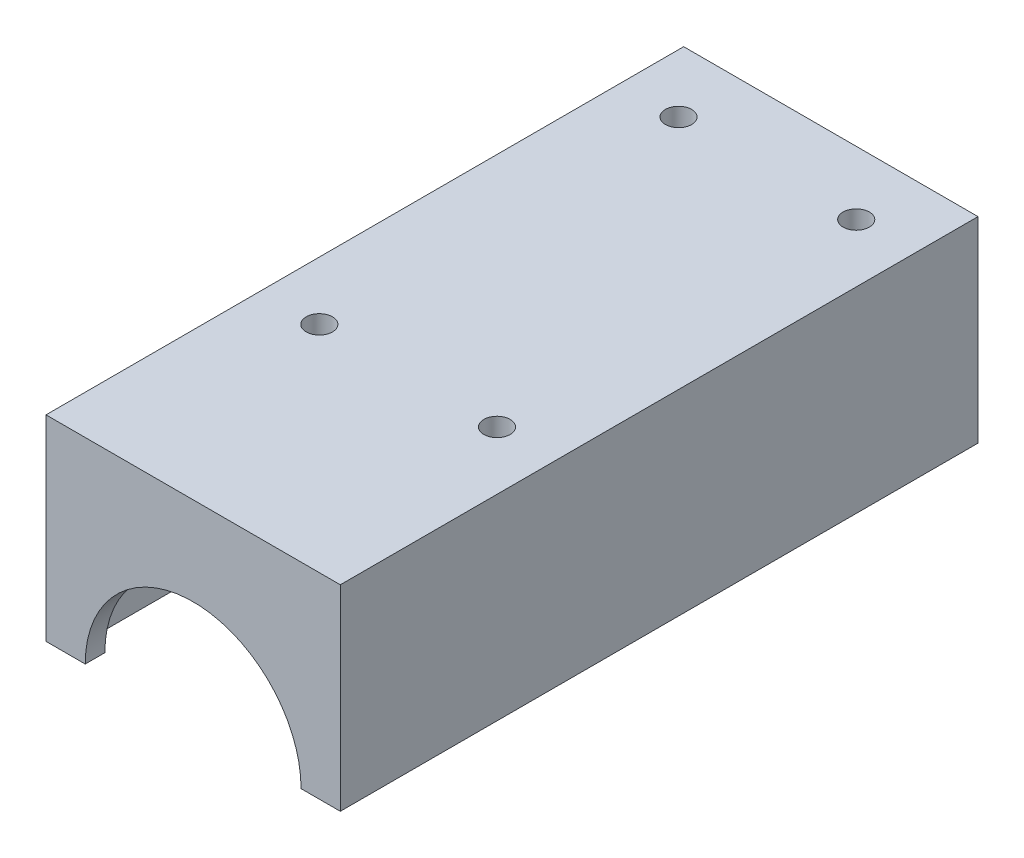
from build123d import *

# Parameters (mm, degrees)
SKETCH1_W           = 38.1
SKETCH1_H           = 82.55
BOSS_EXTRUDE1_DEPTH = 12.7
SHELL1_T            = -2.54
SKETCH2_R           = 13.97
CUT_EXTRUDE1_DEPTH  = 86.666183527
SKETCH3_R           = 1.7
CUT_EXTRUDE2_DEPTH  = 51.883275494
EXTRUDE_THIN1_START = 11.43
SKETCH4_R           = 2.97
SKETCH4_R_2         = 1.7
EXTRUDE_THIN1_DEPTH = 11.43
CUT_EXTRUDE3_DEPTH  = 2.54


with BuildPart() as part:
    # Sketch1 → Boss-Extrude1 (new, symmetric)
    with BuildSketch(Plane(origin=(0, 0, 0), x_dir=(1, 0, 0), z_dir=(0, 1, 0))):
        Rectangle(SKETCH1_W, SKETCH1_H)
    extrude(amount=BOSS_EXTRUDE1_DEPTH, both=True)

    # Shell1
    shell1_openings = [part.faces().sort_by_distance(p)[0] for p in [
        (0, -12.7, 0),
    ]]
    offset(amount=SHELL1_T, openings=shell1_openings, kind=Kind.INTERSECTION)

    # Sketch2 → Cut-Extrude1 (cut, through all)
    with BuildSketch(Plane(origin=(0, 0, -41.275), x_dir=(-1, 0, 0), z_dir=(0, 0, -1))):
        with Locations((0, -12.7)):
            Circle(SKETCH2_R)
    extrude(amount=-CUT_EXTRUDE1_DEPTH, mode=Mode.SUBTRACT)

    # Sketch3 → Cut-Extrude2 (cut, through all)
    with BuildSketch(Plane.XZ.offset(-10.16)):
        with Locations(Location((11.5, 13.44, 0), (0, 0, 270))):
            Circle(SKETCH3_R)
        with Locations(Location((11.5, -33.06, 0), (0, 0, 270))):
            Circle(SKETCH3_R)
        with Locations(Location((-11.5, -33.06, 0), (0, 0, 270))):
            Circle(SKETCH3_R)
        with Locations(Location((-11.5, 13.44, 0), (0, 0, 270))):
            Circle(SKETCH3_R)
    extrude(amount=-CUT_EXTRUDE2_DEPTH, mode=Mode.SUBTRACT)

    # Sketch4 → Extrude-Thin1 (add)
    # profile 1 of 4: a face of its own
    with BuildSketch(Plane.XZ.offset(-10.16).offset(EXTRUDE_THIN1_START)):
        with Locations((11.5, 13.44)):
            Circle(SKETCH4_R)
        with Locations((11.5, 13.44)):
            Circle(SKETCH4_R_2, mode=Mode.SUBTRACT)
    # profile 2 of 4: a face of its own
    with BuildSketch(Plane.XZ.offset(-10.16).offset(EXTRUDE_THIN1_START)):
        with Locations((-11.5, 13.44)):
            Circle(SKETCH4_R)
        with Locations((-11.5, 13.44)):
            Circle(SKETCH4_R_2, mode=Mode.SUBTRACT)
    # profile 3 of 4: a face of its own
    with BuildSketch(Plane.XZ.offset(-10.16).offset(EXTRUDE_THIN1_START)):
        with Locations((-11.5, -33.06)):
            Circle(SKETCH4_R)
        with Locations((-11.5, -33.06)):
            Circle(SKETCH4_R_2, mode=Mode.SUBTRACT)
    # profile 4 of 4: a face of its own
    with BuildSketch(Plane.XZ.offset(-10.16).offset(EXTRUDE_THIN1_START)):
        with Locations((11.5, -33.06)):
            Circle(SKETCH4_R)
        with Locations((11.5, -33.06)):
            Circle(SKETCH4_R_2, mode=Mode.SUBTRACT)
    extrude(amount=-EXTRUDE_THIN1_DEPTH)

    # Sketch5 → Cut-Extrude3 (cut)
    with BuildSketch(Plane.XZ.offset(1.27)):
        Polygon((-10.16, -15.94), (-9.525, -15.94), (-9.525, -36.83), (9.525, -36.83), (9.525, -15.94), (10.16, -15.94), (10.16, 15.94), (-10.16, 15.94), align=None)
    extrude(amount=-CUT_EXTRUDE3_DEPTH, mode=Mode.SUBTRACT)


solid = part.part
